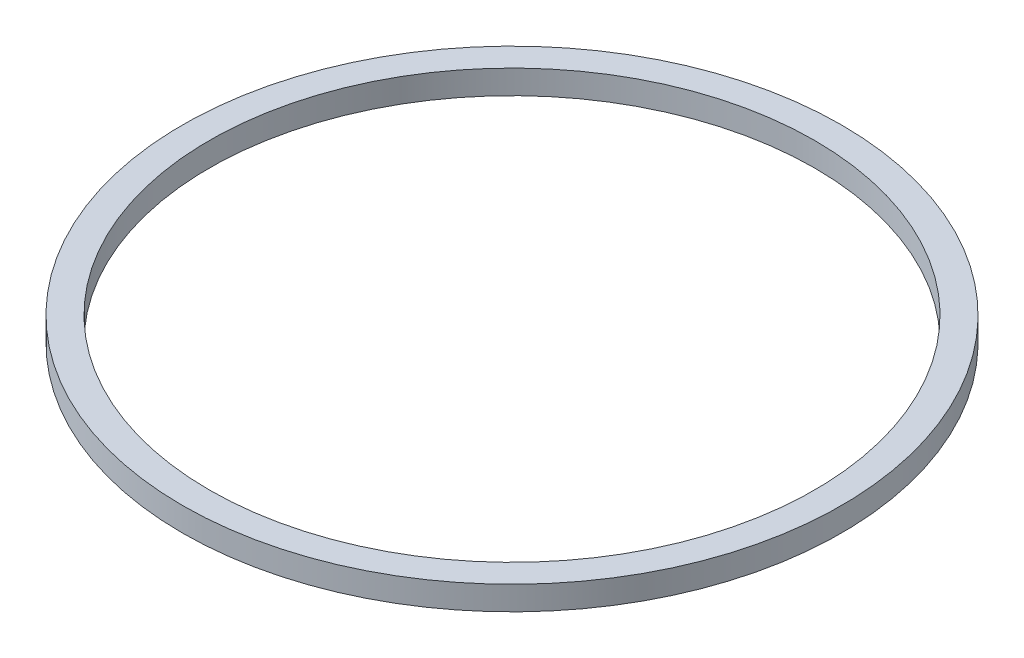
from build123d import *

# Parameters (mm, degrees)
SKETCH1_R           = 87.5284
SKETCH1_R_2         = 80.391
BOSS_EXTRUDE1_DEPTH = 6.35


with BuildPart() as part:
    # Sketch1 → Boss-Extrude1 (new body)
    with BuildSketch(Plane(origin=(0, 0, 0), x_dir=(1, 0, 0), z_dir=(0, 1, 0))):
        with Locations(Location((0, 0, 0), (0, 0, 270))):
            Circle(SKETCH1_R)
        with Locations(Location((0, 0, 0), (0, 0, 270))):
            Circle(SKETCH1_R_2, mode=Mode.SUBTRACT)
    extrude(amount=BOSS_EXTRUDE1_DEPTH)


solid = part.part
